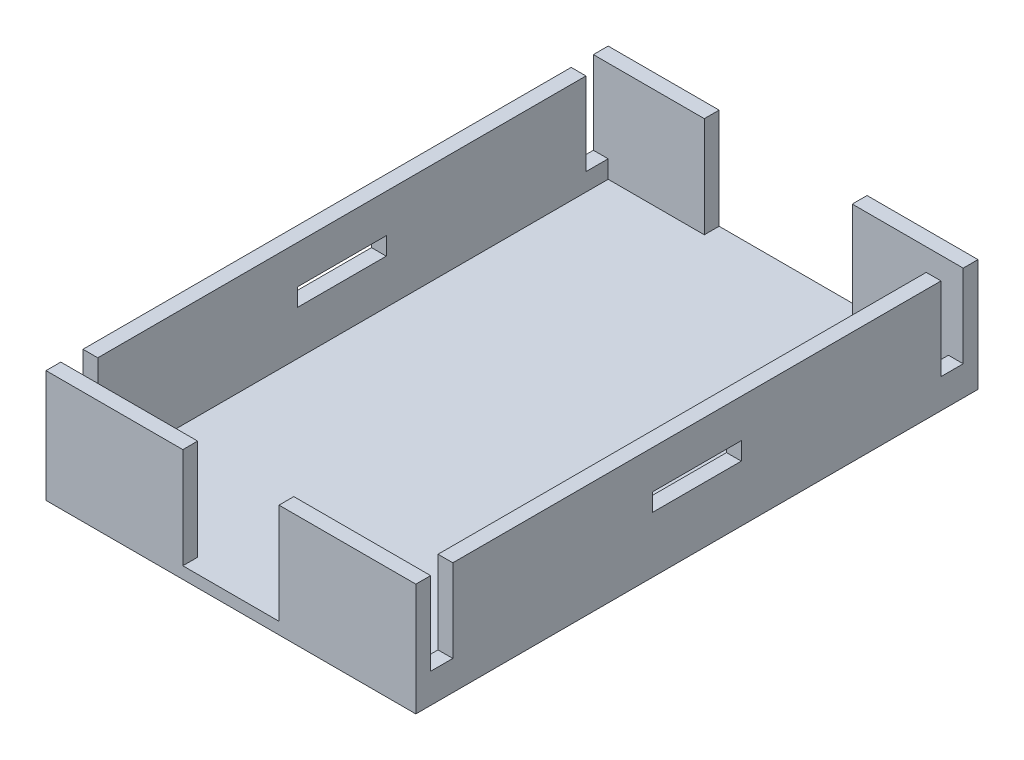
from build123d import *

# Parameters (mm, degrees)
SKETCH1_W               = 25
SKETCH1_H               = 38
BOSS_EXTRUDE1_DEPTH     = 7.6
SKETCH2_W               = 23
SKETCH2_H               = 36
CUT_EXTRUDE1_DEPTH      = 6.8
SKETCH2_3_W             = 1
SKETCH2_3_H             = 1.5
CUT_EXTRUDE2_DEPTH      = 5.6
CUT_EXTRUDE3_DEPTH      = 24.97936613
CUT_EXTRUDE3_DEPTH_BACK = 24.97936613
SKETCH3_W               = 6
SKETCH3_H               = 1.2
SKETCH4_W               = 6.5
SKETCH4_H               = 1
SKETCH4_W_2             = 10
CUT_EXTRUDE4_DEPTH      = 6.8


with BuildPart() as part:
    # Sketch1 → Boss-Extrude1 (new body)
    with BuildSketch(Plane(origin=(0, 0, 0), x_dir=(1, 0, 0), z_dir=(0, 1, 0))):
        Rectangle(SKETCH1_W, SKETCH1_H)
    extrude(amount=BOSS_EXTRUDE1_DEPTH)

    # Sketch2 → Cut-Extrude1 (cut)
    with BuildSketch(Plane(origin=(0, 7.6, 0), x_dir=(1, 0, 0), z_dir=(0, 1, 0))):
        Rectangle(SKETCH2_W, SKETCH2_H)
    extrude(amount=-CUT_EXTRUDE1_DEPTH, mode=Mode.SUBTRACT)

    # Sketch2<3> → Cut-Extrude2 (cut)
    with BuildSketch(Plane(origin=(0, 7.6, 0), x_dir=(1, 0, 0), z_dir=(0, 1, 0))):
        with Locations((-12, 17.25)):
            Rectangle(SKETCH2_3_W, SKETCH2_3_H)
        with Locations((12, 17.25)):
            Rectangle(SKETCH2_3_W, SKETCH2_3_H)
        with Locations((-12, -17.25)):
            Rectangle(SKETCH2_3_W, SKETCH2_3_H)
        with Locations((12, -17.25)):
            Rectangle(SKETCH2_3_W, SKETCH2_3_H)
    extrude(amount=-CUT_EXTRUDE2_DEPTH, mode=Mode.SUBTRACT)

    # Sketch3 → Cut-Extrude3 (cut, two sides: drawn at the far end of the back side and taken through both)
    with BuildSketch(Plane(origin=(0, 0, 0), x_dir=(0, 0, -1), z_dir=(1, 0, 0)).offset(-CUT_EXTRUDE3_DEPTH_BACK)):
        with Locations((0, 4.4)):
            Rectangle(SKETCH3_W, SKETCH3_H)
    extrude(amount=CUT_EXTRUDE3_DEPTH + CUT_EXTRUDE3_DEPTH_BACK, mode=Mode.SUBTRACT)

    # Sketch4 → Cut-Extrude4 (cut)
    with BuildSketch(Plane(origin=(0, 7.6, 0), x_dir=(1, 0, 0), z_dir=(0, 1, 0))):
        with Locations((0, -18.5)):
            Rectangle(SKETCH4_W, SKETCH4_H)
        with Locations((0, 18.5)):
            Rectangle(SKETCH4_W_2, SKETCH4_H)
    extrude(amount=-CUT_EXTRUDE4_DEPTH, mode=Mode.SUBTRACT)


solid = part.part
